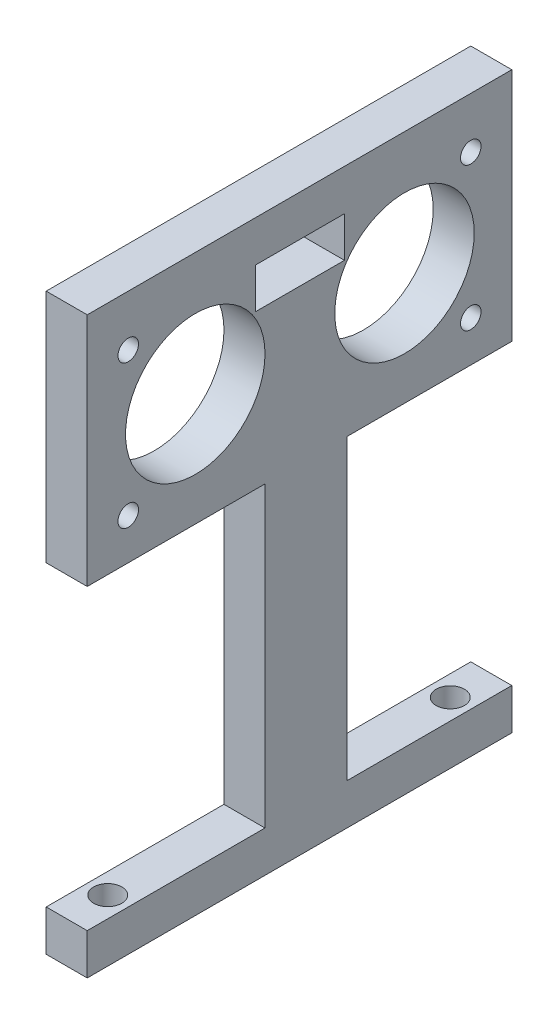
from build123d import *

# Parameters (mm, degrees)
BOSS_EXTRUDE1_DEPTH = 5.08
SKETCH2_W           = 101.6
SKETCH2_H           = 10.16
CUT_EXTRUDE3_DEPTH  = 22.86
SKETCH9_R           = 1.27
CUT_EXTRUDE4_DEPTH  = 25.908
SKETCH13_W          = 11.0236
SKETCH13_H          = 5.0038
CUT_EXTRUDE5_DEPTH  = 25.908
SKETCH8_R           = 8.636
CUT_EXTRUDE6_DEPTH  = 25.908
SKETCH14_W          = 212.203069611
SKETCH14_H          = 122.52066239
SKETCH14_W_2        = 52.5744
SKETCH14_H_2        = 29.137232508
CUT_EXTRUDE7_DEPTH  = 25.908
SKETCH15_W          = 52.5744
SKETCH15_H          = 43.722211583
BOSS_EXTRUDE2_DEPTH = 5.08
SKETCH17_W          = 25.579382718
SKETCH17_H          = 36.902767492
CUT_EXTRUDE8_DEPTH  = 10.16
SKETCH18_R          = 1.7526
CUT_EXTRUDE9_DEPTH  = 10.16


with BuildPart() as part:
    # Sketch1 → Boss-Extrude1 (new body)
    with BuildSketch(Plane(origin=(0, 0, 0), x_dir=(0, 0, -1), z_dir=(1, 0, 0))):
        Polygon((62.997029703, -55.82970297), (88.397029703, -55.82970297), (88.397029703, -65.98970297), (-89.402970297, -65.98970297), (-89.402970297, -55.82970297), (-64.002970297, -55.82970297), (-64.002970297, 27.837475742), (62.997029703, 27.837475742), align=None)
    extrude(amount=BOSS_EXTRUDE1_DEPTH)

    # Sketch2 → Cut-Extrude3 (cut)
    with BuildSketch(Plane(origin=(0, 0, 0), x_dir=(0, 0, -1), z_dir=(1, 0, 0))):
        with Locations((-0.502970297, -60.90970297)):
            Rectangle(SKETCH2_W, SKETCH2_H)
    extrude(amount=CUT_EXTRUDE3_DEPTH, mode=Mode.SUBTRACT)

    # Sketch9 → Cut-Extrude4 (cut)
    with BuildSketch(Plane(origin=(0, 0, 0), x_dir=(0, 0, -1), z_dir=(1, 0, 0))):
        with Locations((-22.010170297, -1.223907747)):
            Circle(SKETCH9_R)
        with Locations(Location((-22.010170297, -18.977232508, 0), (0, 0, 180))):
            Circle(SKETCH9_R)
        with Locations((20.404229703, -18.977232508)):
            Circle(SKETCH9_R)
        with Locations(Location((20.404229703, -1.223907747, 0), (0, 0, 180))):
            Circle(SKETCH9_R)
    extrude(amount=CUT_EXTRUDE4_DEPTH, mode=Mode.SUBTRACT)

    # Sketch13 → Cut-Extrude5 (cut)
    with BuildSketch(Plane(origin=(0, 0, 0), x_dir=(0, 0, -1), z_dir=(1, 0, 0))):
        with Locations((-0.746414126, -2.5019)):
            Rectangle(SKETCH13_W, SKETCH13_H)
    extrude(amount=CUT_EXTRUDE5_DEPTH, mode=Mode.SUBTRACT)

    # Sketch8 → Cut-Extrude6 (cut)
    with BuildSketch(Plane(origin=(0, 0, 0), x_dir=(0, 0, -1), z_dir=(1, 0, 0))):
        with Locations((12.197029703, -10.100570128)):
            Circle(SKETCH8_R)
        with Locations((-13.710970297, -10.100570128)):
            Circle(SKETCH8_R)
    extrude(amount=CUT_EXTRUDE6_DEPTH, mode=Mode.SUBTRACT)

    # Sketch14 → Cut-Extrude7 (cut)
    with BuildSketch(Plane(origin=(0, 0, 0), x_dir=(0, 0, -1), z_dir=(1, 0, 0))):
        with Locations((-5.581398167, -16.698007888)):
            Rectangle(SKETCH14_W, SKETCH14_H)
        with Locations((-0.802970297, -9.488616254)):
            Rectangle(SKETCH14_W_2, SKETCH14_H_2, mode=Mode.SUBTRACT)
    extrude(amount=CUT_EXTRUDE7_DEPTH, mode=Mode.SUBTRACT)

    # Sketch15 → Boss-Extrude2 (add)
    with BuildSketch(Plane(origin=(0, 0, 0), x_dir=(0, 0, -1), z_dir=(1, 0, 0))):
        with Locations((-0.802970297, -44.178894209)):
            Rectangle(SKETCH15_W, SKETCH15_H)
    extrude(amount=BOSS_EXTRUDE2_DEPTH)

    # Sketch17 → Cut-Extrude8 (cut)
    with BuildSketch(Plane(origin=(0, 0, 0), x_dir=(0, 0, -1), z_dir=(1, 0, 0))):
        with Locations((-17.869691359, -42.508616254)):
            Rectangle(SKETCH17_W, SKETCH17_H)
        with Locations((17.869691359, -42.508616254)):
            Rectangle(SKETCH17_W, SKETCH17_H)
    extrude(amount=CUT_EXTRUDE8_DEPTH, mode=Mode.SUBTRACT)

    # Sketch18 → Cut-Extrude9 (cut)
    with BuildSketch(Plane(origin=(0, -66.04, 0), x_dir=(1, 0, 0), z_dir=(0, 1, 0))):
        with Locations(Location((2.54, -22.010170297, 0), (0, 0, 270))):
            Circle(SKETCH18_R)
        with Locations(Location((2.54, 20.404229703, 0), (0, 0, 90))):
            Circle(SKETCH18_R)
    extrude(amount=CUT_EXTRUDE9_DEPTH, mode=Mode.SUBTRACT)


solid = part.part
